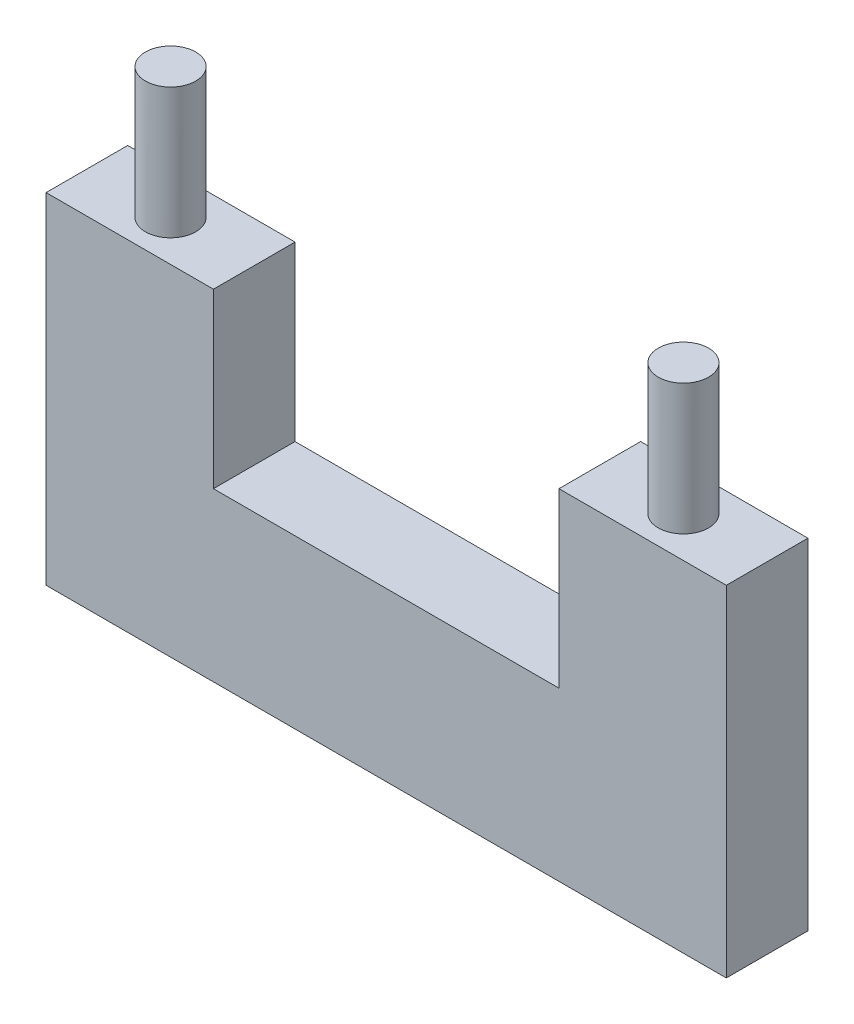
from build123d import *

# Parameters (mm, degrees)
SKETCH1_W           = 25
SKETCH1_H           = 12.5
BOSS_EXTRUDE1_DEPTH = 3
SKETCH2_W           = 12.7
SKETCH2_H           = 6.35
CUT_EXTRUDE1_DEPTH  = 3
SKETCH3_R           = 0.925
BOSS_EXTRUDE2_DEPTH = 4.8


with BuildPart() as part:
    # Sketch1 → Boss-Extrude1 (new body)
    with BuildSketch(Plane.XY):
        Rectangle(SKETCH1_W, SKETCH1_H)
    extrude(amount=BOSS_EXTRUDE1_DEPTH)

    # Sketch2 → Cut-Extrude1 (cut)
    with BuildSketch(Plane.XY.offset(3)):
        with Locations((0, 3.075)):
            Rectangle(SKETCH2_W, SKETCH2_H)
    extrude(amount=-CUT_EXTRUDE1_DEPTH, mode=Mode.SUBTRACT)

    # Sketch3 → Boss-Extrude2 (add)
    with BuildSketch(Plane(origin=(0, 6.25, 0), x_dir=(1, 0, 0), z_dir=(0, 1, 0))):
        with Locations(Location((-9.425, -1.5, 0), (0, 0, 90))):
            Circle(SKETCH3_R)
        with Locations(Location((9.425, -1.5, 0), (0, 0, 90))):
            Circle(SKETCH3_R)
    extrude(amount=BOSS_EXTRUDE2_DEPTH)


solid = part.part
